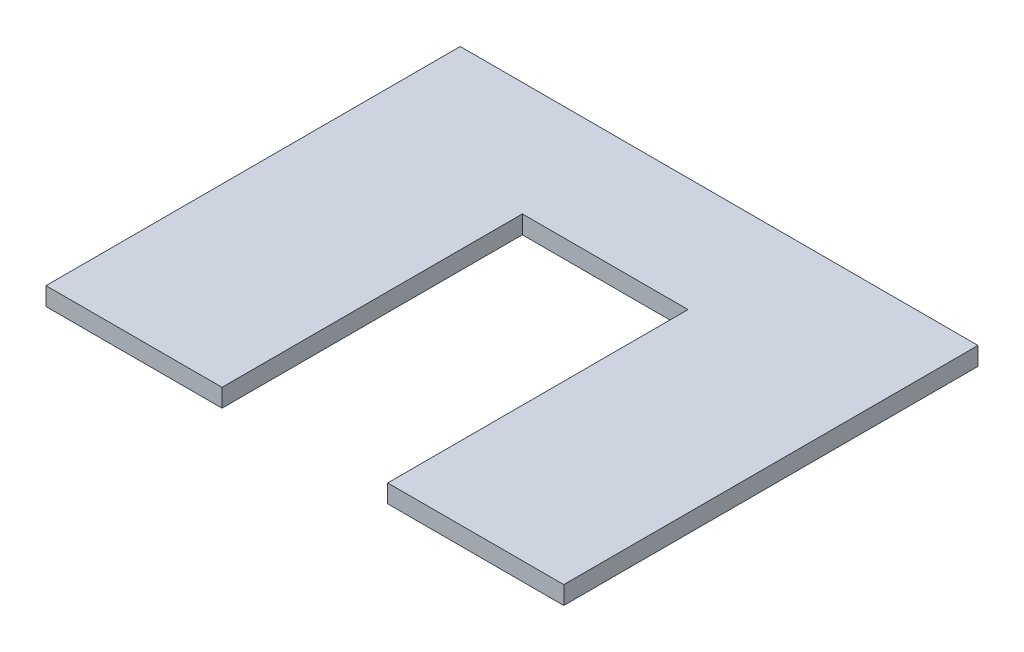
from build123d import *

# Parameters (mm, degrees)
BOSS_EXTRUDE1_DEPTH = 1.75


with BuildPart() as part:
    # Sketch1 → Boss-Extrude1 (new body)
    with BuildSketch(Plane(origin=(0, 0, 0), x_dir=(1, 0, 0), z_dir=(0, 1, 0))):
        Polygon((17, -40), (17, -11), (33, -11), (33, -40), (50, -40), (50, 0), (0, 0), (0, -40), align=None)
    extrude(amount=BOSS_EXTRUDE1_DEPTH)


solid = part.part
